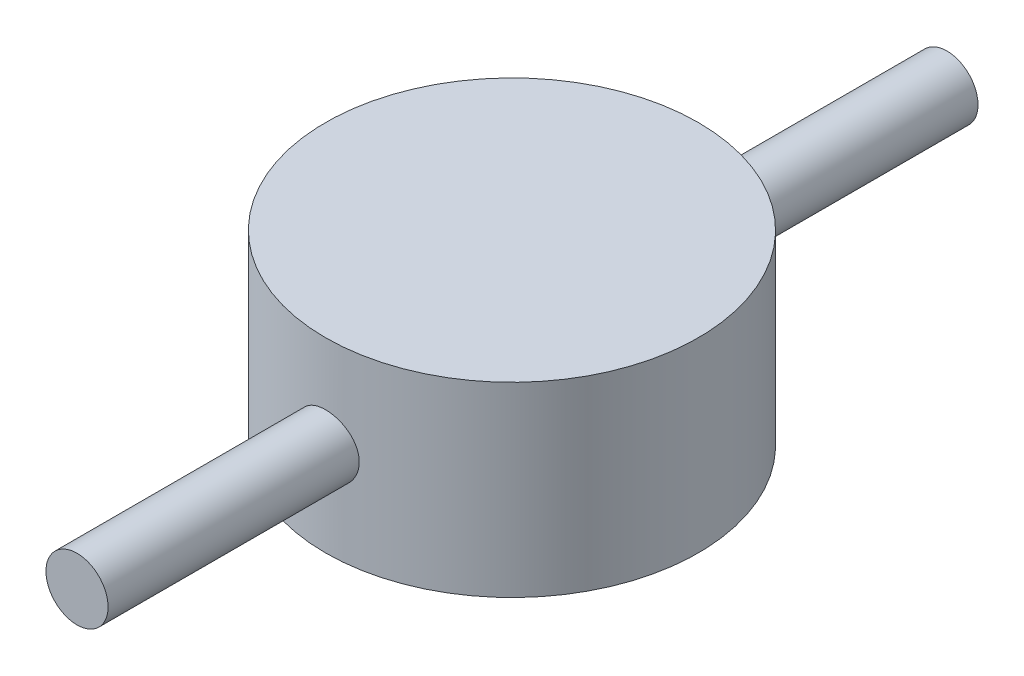
from build123d import *

# Parameters (mm, degrees)
SKETCH1_R                = 15
BOSS_EXTRUDE1_DEPTH      = 15
BOSS_EXTRUDE2_DEPTH      = 35
BOSS_EXTRUDE2_DEPTH_BACK = 35
SKETCH2_R                = 2.5


with BuildPart() as part:
    # Sketch1 → Boss-Extrude1 (new body)
    with BuildSketch(Plane(origin=(0, 0, 0), x_dir=(1, 0, 0), z_dir=(0, 1, 0))):
        Circle(SKETCH1_R)
    extrude(amount=BOSS_EXTRUDE1_DEPTH)

    # Sketch2 → Boss-Extrude2 (add, two sides: drawn at the far end of the back side and taken through both)
    with BuildSketch(Plane.XY.offset(-BOSS_EXTRUDE2_DEPTH_BACK)):
        with Locations((0, 7.484573098)):
            Circle(SKETCH2_R)
    extrude(amount=BOSS_EXTRUDE2_DEPTH + BOSS_EXTRUDE2_DEPTH_BACK)


solid = part.part
